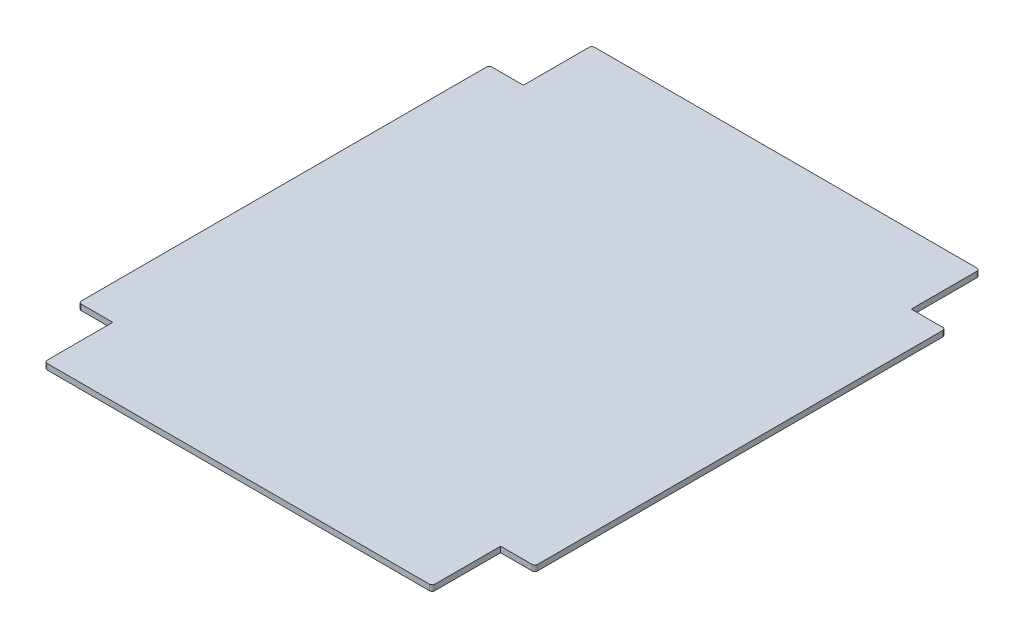
from build123d import *

# Parameters (mm, degrees)
BOSS_EXTRUDE1_DEPTH = 6.35
FILLET2_R           = 3.175


with BuildPart() as part:
    # Sketch1 → Boss-Extrude1 (new body)
    with BuildSketch(Plane(origin=(0, 0, 0), x_dir=(1, 0, 0), z_dir=(0, 1, 0))):
        Polygon((-215.9, 304.8), (215.9, 304.8), (215.9, 228.6), (254, 228.6), (254, -228.6), (215.9, -228.6), (215.9, -304.8), (-215.9, -304.8), (-215.9, -228.6), (-254, -228.6), (-254, 228.6), (-215.9, 228.6), align=None)
    extrude(amount=BOSS_EXTRUDE1_DEPTH)

    # Fillet2
    fillet2_edges = [part.edges().sort_by_distance(p)[0] for p in [
        (-254, 3.175, 228.6),
        (-254, 3.175, -228.6),
        (-215.9, 3.175, -304.8),
        (215.9, 3.175, -304.8),
        (254, 3.175, -228.6),
        (254, 3.175, 228.6),
        (215.9, 3.175, 304.8),
        (-215.9, 3.175, 304.8),
    ]]
    fillet(fillet2_edges, radius=FILLET2_R)


solid = part.part
